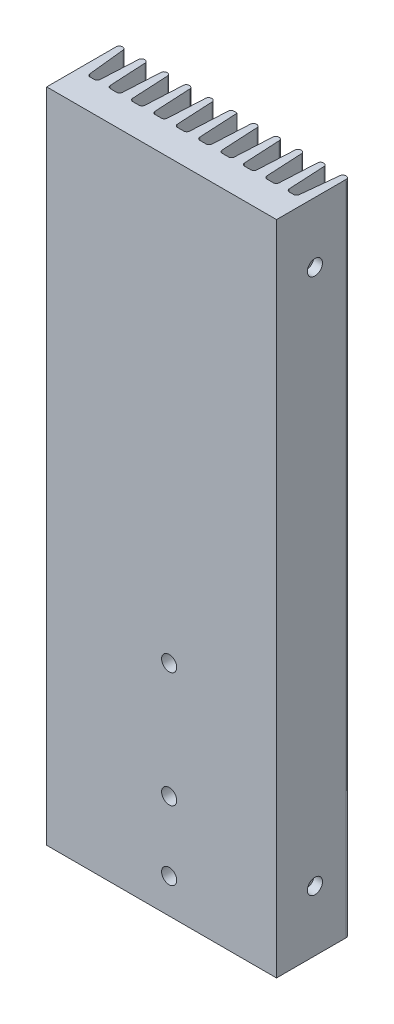
from build123d import *

# Parameters (mm, degrees)
EXTRUDE1_DEPTH            = 108.6
BOSS_EXTRUDE1_DEPTH       = 108.6
LPATTERN1_COUNT           = 9
LPATTERN1_PITCH           = 3.7
FILLET1_R                 = 0.5
FILLET2_R                 = 0.5
M3X0_5_TAPPED_HOLE1_D     = 2.5
M3X0_5_TAPPED_HOLE1_DEPTH = 6.5
M3X0_5_TAPPED_HOLE1_TIP   = 0.751075774
M3X0_5_TAPPED_HOLE2_D     = 2.5
M3X0_5_TAPPED_HOLE2_DEPTH = 5
M3X0_5_TAPPED_HOLE2_TIP   = 0.751075774


with BuildPart() as part:
    # Sketch1 → Extrude1 (new body)
    with BuildSketch(Plane(origin=(0, 0, 0), x_dir=(1, 0, 0), z_dir=(0, 1, 0))):
        Polygon((0, 12), (0, 0), (38, 0), (38, 12), (37, 12), (36.264270353, 5), (1.735729647, 5), (1, 12), align=None)
    extrude(amount=EXTRUDE1_DEPTH)

    # Sketch3 → Boss-Extrude1 (add)
    with BuildSketch(Plane(origin=(0, 108.6, 0), x_dir=(1, 0, 0), z_dir=(0, 1, 0))):
        Polygon((3.333145545, 5), (3.7, 12), (4.7, 12), (5.066854455, 5), align=None)
    boss_extrude1 = extrude(amount=-BOSS_EXTRUDE1_DEPTH)

    # LPattern1: Boss-Extrude1 ×9
    with Locations(*[(i * LPATTERN1_PITCH, 0, 0) for i in range(1, LPATTERN1_COUNT)]):
        add(boss_extrude1)

    # Fillet1
    fillet1_edges = [part.edges().sort_by_distance(p)[0] for p in [
        (34.666854455, 54.3, -5),
        (32.933145545, 54.3, -5),
        (1.735729647, 54.3, -5),
        (36.264270353, 54.3, -5),
        (5.066854455, 54.3, -5),
        (3.333145545, 54.3, -5),
        (8.766854455, 54.3, -5),
        (7.033145545, 54.3, -5),
        (12.466854455, 54.3, -5),
        (10.733145545, 54.3, -5),
        (16.166854455, 54.3, -5),
        (14.433145545, 54.3, -5),
        (19.866854455, 54.3, -5),
        (18.133145545, 54.3, -5),
        (23.566854455, 54.3, -5),
        (21.833145545, 54.3, -5),
        (27.266854455, 54.3, -5),
        (25.533145545, 54.3, -5),
        (30.966854455, 54.3, -5),
        (29.233145545, 54.3, -5),
    ]]
    fillet(fillet1_edges, radius=FILLET1_R)

    # Fillet2
    fillet2_edges = [part.edges().sort_by_distance(p)[0] for p in [
        (33.3, 54.3, -12),
        (34.3, 54.3, -12),
        (1, 54.3, -12),
        (37, 54.3, -12),
        (38, 54.3, -12),
        (0, 54.3, -12),
        (3.7, 54.3, -12),
        (4.7, 54.3, -12),
        (7.4, 54.3, -12),
        (8.4, 54.3, -12),
        (11.1, 54.3, -12),
        (12.1, 54.3, -12),
        (14.8, 54.3, -12),
        (15.8, 54.3, -12),
        (18.5, 54.3, -12),
        (22.2, 54.3, -12),
        (23.2, 54.3, -12),
        (25.9, 54.3, -12),
        (26.9, 54.3, -12),
        (29.6, 54.3, -12),
        (30.6, 54.3, -12),
    ]]
    fillet(fillet2_edges, radius=FILLET2_R)

    # M3x0.5 Tapped Hole1
    with Locations(Plane(origin=(38, 0, 0), x_dir=(0, 0, -1), z_dir=(1, 0, 0))):
        with Locations((6.35, 98.6), (6.35, 10)):
            Hole(M3X0_5_TAPPED_HOLE1_D / 2, depth=M3X0_5_TAPPED_HOLE1_DEPTH)
            with Locations((0, 0, -(M3X0_5_TAPPED_HOLE1_DEPTH + M3X0_5_TAPPED_HOLE1_TIP / 2))):  # 118° drill point
                Cone(0, M3X0_5_TAPPED_HOLE1_D / 2, M3X0_5_TAPPED_HOLE1_TIP, mode=Mode.SUBTRACT)

    # M3x0.5 Tapped Hole2
    with Locations(Plane.XY):
        with Locations((20.25, 36.21), (20.25, 17.16), (20.25, 5.73)):
            Hole(M3X0_5_TAPPED_HOLE2_D / 2, depth=M3X0_5_TAPPED_HOLE2_DEPTH)
            with Locations((0, 0, -(M3X0_5_TAPPED_HOLE2_DEPTH + M3X0_5_TAPPED_HOLE2_TIP / 2))):  # 118° drill point
                Cone(0, M3X0_5_TAPPED_HOLE2_D / 2, M3X0_5_TAPPED_HOLE2_TIP, mode=Mode.SUBTRACT)


solid = part.part
